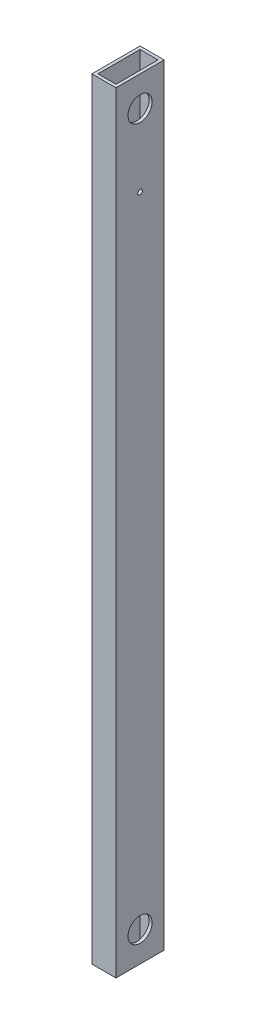
from build123d import *

# Parameters (mm, degrees)
SKETCH1_W           = 25.4
SKETCH1_H           = 50.8
BOSS_EXTRUDE1_DEPTH = 406.4
SHELL1_T            = -3.175
SKETCH2_R           = 12.7
SKETCH2_R_2         = 2.4892
CUT_EXTRUDE1_DEPTH  = 411.349558304


with BuildPart() as part:
    # Sketch1 → Boss-Extrude1 (new, symmetric)
    with BuildSketch(Plane(origin=(0, 0, 0), x_dir=(1, 0, 0), z_dir=(0, 1, 0))):
        with Locations((12.7, 25.4)):
            Rectangle(SKETCH1_W, SKETCH1_H)
    extrude(amount=BOSS_EXTRUDE1_DEPTH, both=True)

    # Shell1
    shell1_openings = [part.faces().sort_by_distance(p)[0] for p in [
        (12.7, 406.4, -25.4),
        (12.7, -406.4, -25.4),
    ]]
    offset(amount=SHELL1_T, openings=shell1_openings, kind=Kind.INTERSECTION)

    # Sketch2 → Cut-Extrude1 (cut, through all)
    with BuildSketch(Plane(origin=(25.4, 0, 0), x_dir=(0, 0, -1), z_dir=(1, 0, 0))):
        with Locations((25.4, 374.65)):
            Circle(SKETCH2_R)
        with Locations((25.4, -374.65)):
            Circle(SKETCH2_R)
        with Locations((25.4, 298.45)):
            Circle(SKETCH2_R_2)
    extrude(amount=-CUT_EXTRUDE1_DEPTH, mode=Mode.SUBTRACT)


solid = part.part
